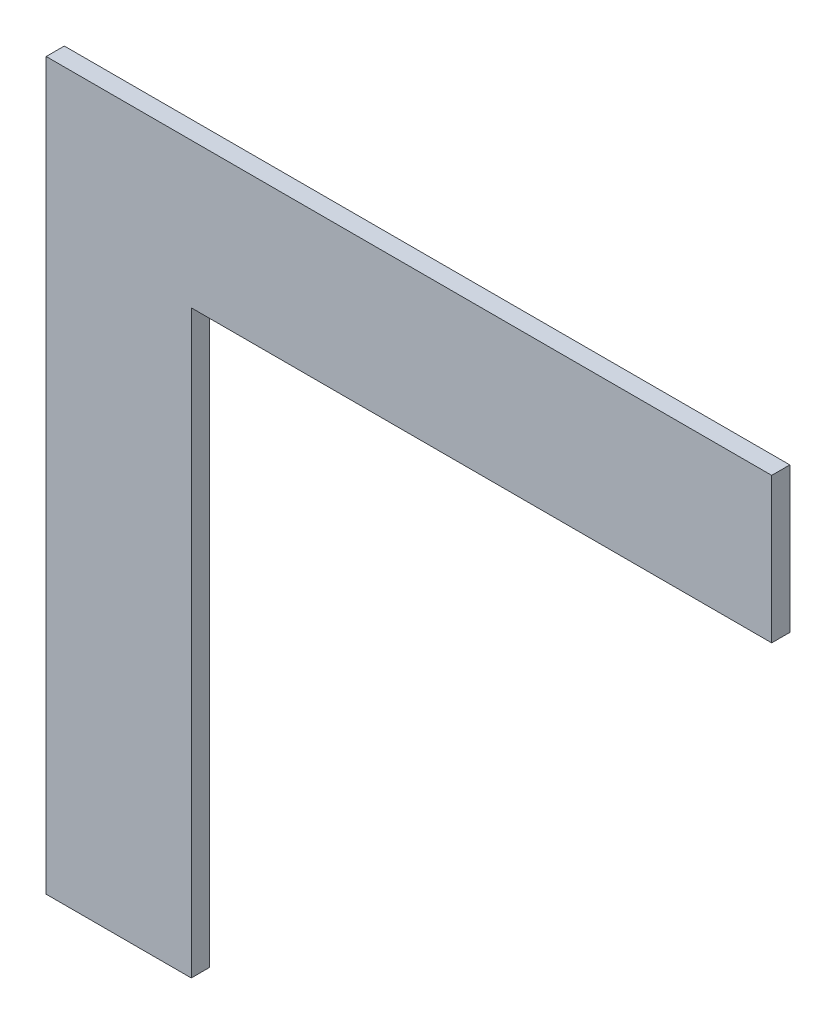
from build123d import *

# Parameters (mm, degrees)
BOSS_EXTRUDE1_DEPTH = 6.35


with BuildPart() as part:
    # Sketch1 → Boss-Extrude1 (new body)
    with BuildSketch(Plane.XY):
        Polygon((0, 0), (0, 203.2), (203.2, 203.2), (203.2, 254), (-50.8, 254), (-50.8, 0), align=None)
    extrude(amount=BOSS_EXTRUDE1_DEPTH)


solid = part.part
